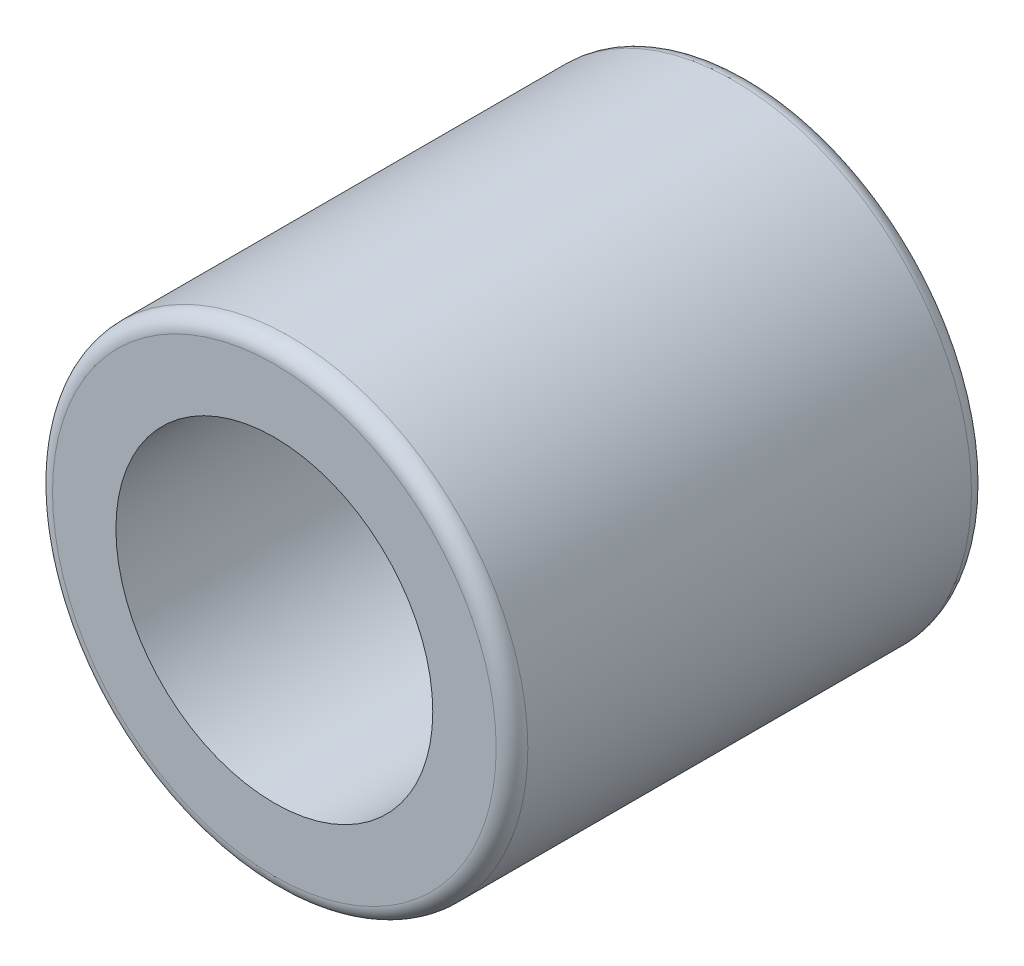
from build123d import *

# Parameters (mm, degrees)
IZIM3_R                     = 15
IZIM3_R_2                   = 10
Y_KSEKLIK_EKSTR_ZYON1_DEPTH = 15
RADYUS1_R                   = 1


with BuildPart() as part:
    # Çizim3 → Yükseklik-Ekstrüzyon1 (new, symmetric)
    with BuildSketch(Plane.XY):
        Circle(IZIM3_R)
        Circle(IZIM3_R_2, mode=Mode.SUBTRACT)
    extrude(amount=Y_KSEKLIK_EKSTR_ZYON1_DEPTH, both=True)

    # Radyus1
    radyus1_edges = [part.edges().sort_by_distance(p)[0] for p in [
        (-15, 0, -15),
        (-15, 0, 15),
    ]]
    fillet(radyus1_edges, radius=RADYUS1_R)


solid = part.part
